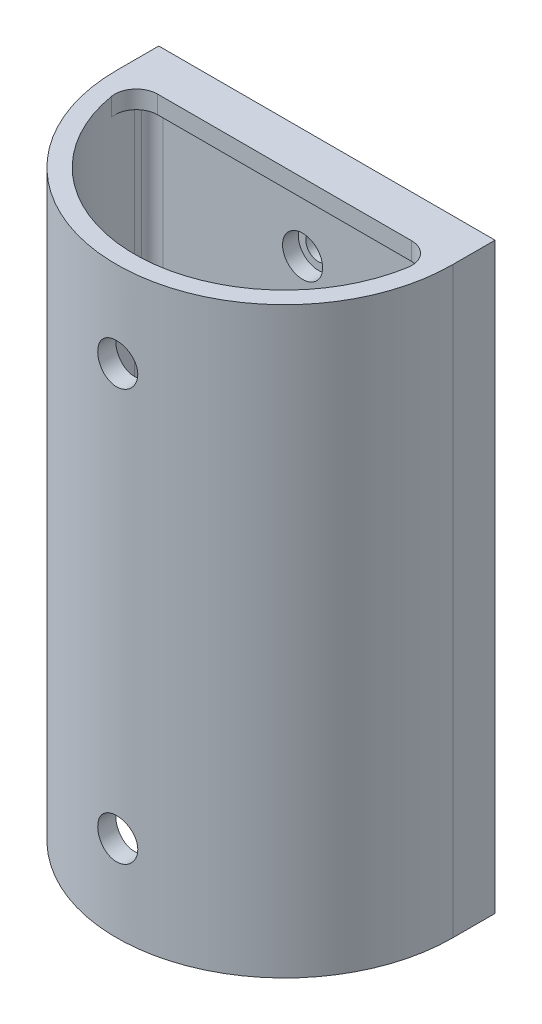
from build123d import *

# Parameters (mm, degrees)
SKETCH1_W           = 47
SKETCH1_H           = 81.5
SKETCH1_R           = 1.75
BOSS_EXTRUDE1_DEPTH = 3.4
SKETCH2_R           = 2.8
CUT_EXTRUDE1_DEPTH  = 2.2
BOSS_EXTRUDE2_DEPTH = 2.5
BOSS_EXTRUDE3_DEPTH = 81.5
SKETCH5_R           = 2.8
CUT_EXTRUDE2_DEPTH  = 54.747674368
FILLET1_R           = 3
FILLET2_R           = 1.5


with BuildPart() as part:
    # Sketch1 → Boss-Extrude1 (new body)
    with BuildSketch(Plane.XY):
        Rectangle(SKETCH1_W, SKETCH1_H)
        with Locations((0, 28.75)):
            Circle(SKETCH1_R, mode=Mode.SUBTRACT)
        with Locations((0, -28.75)):
            Circle(SKETCH1_R, mode=Mode.SUBTRACT)
    extrude(amount=BOSS_EXTRUDE1_DEPTH)

    # Sketch2 → Cut-Extrude1 (cut)
    with BuildSketch(Plane.XY.offset(3.4)):
        with Locations((0, 28.75)):
            Circle(SKETCH2_R)
        with Locations((0, -28.75)):
            Circle(SKETCH2_R)
    extrude(amount=-CUT_EXTRUDE1_DEPTH, mode=Mode.SUBTRACT)

    # Sketch3 → Boss-Extrude2 (add)
    with BuildSketch(Plane.XY.offset(3.4)):
        Polygon((21, -38.25), (21, 38.25), (-21, 38.25), (-21, -38.25), (-21, -40.75), (-23.5, -40.75), (-23.5, 40.75), (23.5, 40.75), (23.5, -40.75), (21, -40.75), align=None)
    extrude(amount=BOSS_EXTRUDE2_DEPTH)

    # Sketch4 → Boss-Extrude3 (add)
    with BuildSketch(Plane(origin=(0, 40.75, 0), x_dir=(1, 0, 0), z_dir=(0, 1, 0))):
        with BuildLine():
            Line((23.5, -5.9), (21, -5.9))
            ThreePointArc((21, -5.9), (0, -26.9), (-21, -5.9))
            Line((-21, -5.9), (-23.5, -5.9))
            ThreePointArc((-23.5, -5.9), (0, -29.4), (23.5, -5.9))
        make_face()
    extrude(amount=-BOSS_EXTRUDE3_DEPTH)

    # Sketch5 → Cut-Extrude2 (cut, through all)
    with BuildSketch(Plane.XY.offset(3.4)):
        with Locations((0, -28.75)):
            Circle(SKETCH5_R)
        with Locations((0, 28.75)):
            Circle(SKETCH5_R)
    extrude(amount=CUT_EXTRUDE2_DEPTH, mode=Mode.SUBTRACT)

    # Fillet1
    fillet1_edges = [part.edges().sort_by_distance(p)[0] for p in [
        (-21, 39.5, 5.9),
        (21, 39.5, 5.9),
    ]]
    fillet(fillet1_edges, radius=FILLET1_R)

    # Fillet2
    fillet2_edges = [part.edges().sort_by_distance(p)[0] for p in [
        (-21, -1.25, 3.4),
        (0, 38.25, 3.4),
        (21, -1.25, 3.4),
    ]]
    fillet(fillet2_edges, radius=FILLET2_R)


solid = part.part
